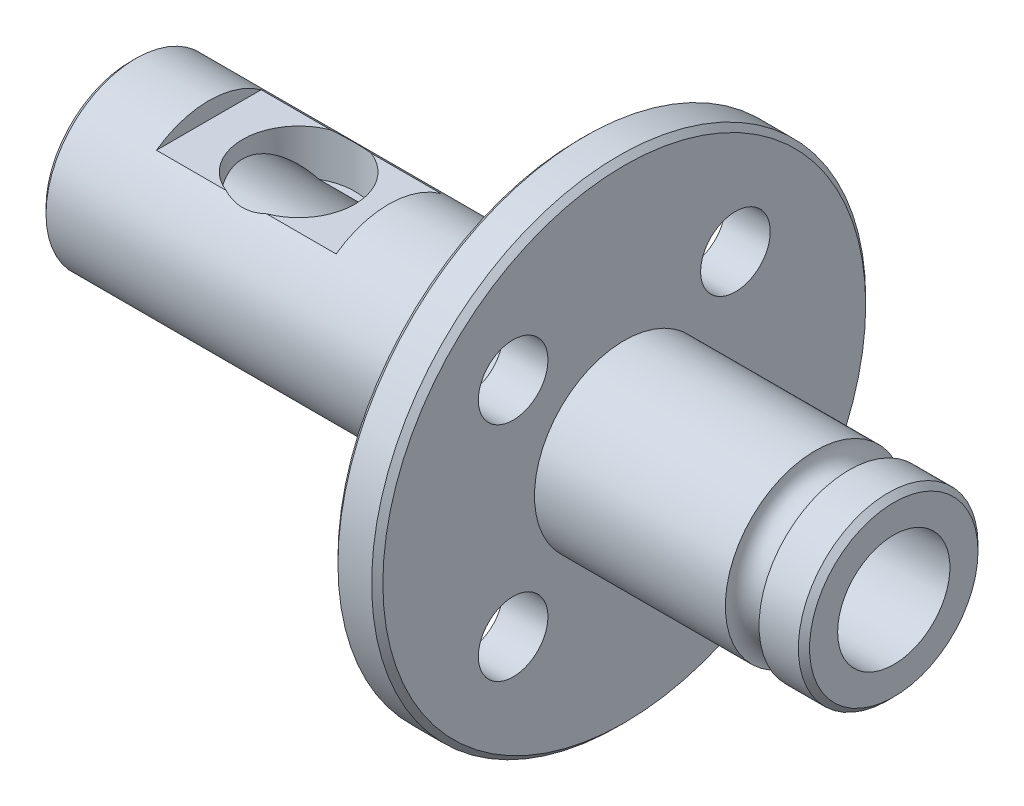
from build123d import *

# Parameters (mm, degrees)
SKETCH2_R          = 1.55
CUT_EXTRUDE1_DEPTH = 26.337718919
SKETCH3_R          = 2.5
CUT_EXTRUDE2_DEPTH = 38.389838192
SKETCH4_W          = 8
SKETCH4_H          = 5
CUT_EXTRUDE3_DEPTH = 0.75
SKETCH5_R          = 2.5
CUT_EXTRUDE4_DEPTH = 2
CHAMFER1_SIZE      = 0.25


with BuildPart() as part:
    # Sketch1 → Revolve1 (revolve)
    with BuildSketch(Plane.XY, mode=Mode.PRIVATE) as revolve1_sk:
        with BuildLine():
            Line((0, 0), (0, 4))
            Line((0, 4), (20, 4))
            Line((20, 4), (20, 11))
            Line((20, 11), (22, 11))
            Line((22, 11), (22, 4))
            Line((22, 4), (30.5, 4))
            ThreePointArc((30.5, 4), (31.25, 3.25), (32, 4))
            Line((32, 4), (34, 4))
            Line((34, 4), (34, 0))
            Line((34, 0), (0, 0))
        make_face()
    revolve(revolve1_sk.sketch.rotate(Axis((34, 0, 0), (-1, 0, 0)), 90), axis=Axis((34, 0, 0), (-1, 0, 0)))

    # Sketch2 → Cut-Extrude1 (cut, through all)
    with BuildSketch(Plane.ZY.offset(-20)):
        with Locations((4.949747468, 4.949747468)):
            Circle(SKETCH2_R)
        with Locations(Location((-4.949747468, 4.949747468, 0), (0, 0, 180))):
            Circle(SKETCH2_R)
        with Locations(Location((4.949747468, -4.949747468, 0), (0, 0, 180))):
            Circle(SKETCH2_R)
        with Locations((-4.949747468, -4.949747468)):
            Circle(SKETCH2_R)
    extrude(amount=-CUT_EXTRUDE1_DEPTH, mode=Mode.SUBTRACT)

    # Sketch3 → Cut-Extrude2 (cut, through all)
    with BuildSketch(Plane.ZY):
        Circle(SKETCH3_R)
    extrude(amount=-CUT_EXTRUDE2_DEPTH, mode=Mode.SUBTRACT)

    # Sketch4 → Cut-Extrude3 (cut)
    with BuildSketch(Plane(origin=(0, 4, 0), x_dir=(1, 0, 0), z_dir=(0, 1, 0))):
        with Locations((7.5, 0)):
            Rectangle(SKETCH4_W, SKETCH4_H)
    extrude(amount=-CUT_EXTRUDE3_DEPTH, mode=Mode.SUBTRACT)

    # Sketch5 → Cut-Extrude4 (cut)
    with BuildSketch(Plane(origin=(0, 3.25, 0), x_dir=(1, 0, 0), z_dir=(0, 1, 0))):
        with Locations(Location((7.5, 0, 0), (0, 0, 248.865707785))):
            Circle(SKETCH5_R)
    extrude(amount=-CUT_EXTRUDE4_DEPTH, mode=Mode.SUBTRACT)

    # Chamfer1
    chamfer1_edges = [part.edges().sort_by_distance(p)[0] for p in [
        (34, 0, 4),
        (0, 0, 4),
        (20, 0, 11),
        (22, 0, 11),
    ]]
    chamfer(chamfer1_edges, length=CHAMFER1_SIZE)


solid = part.part
